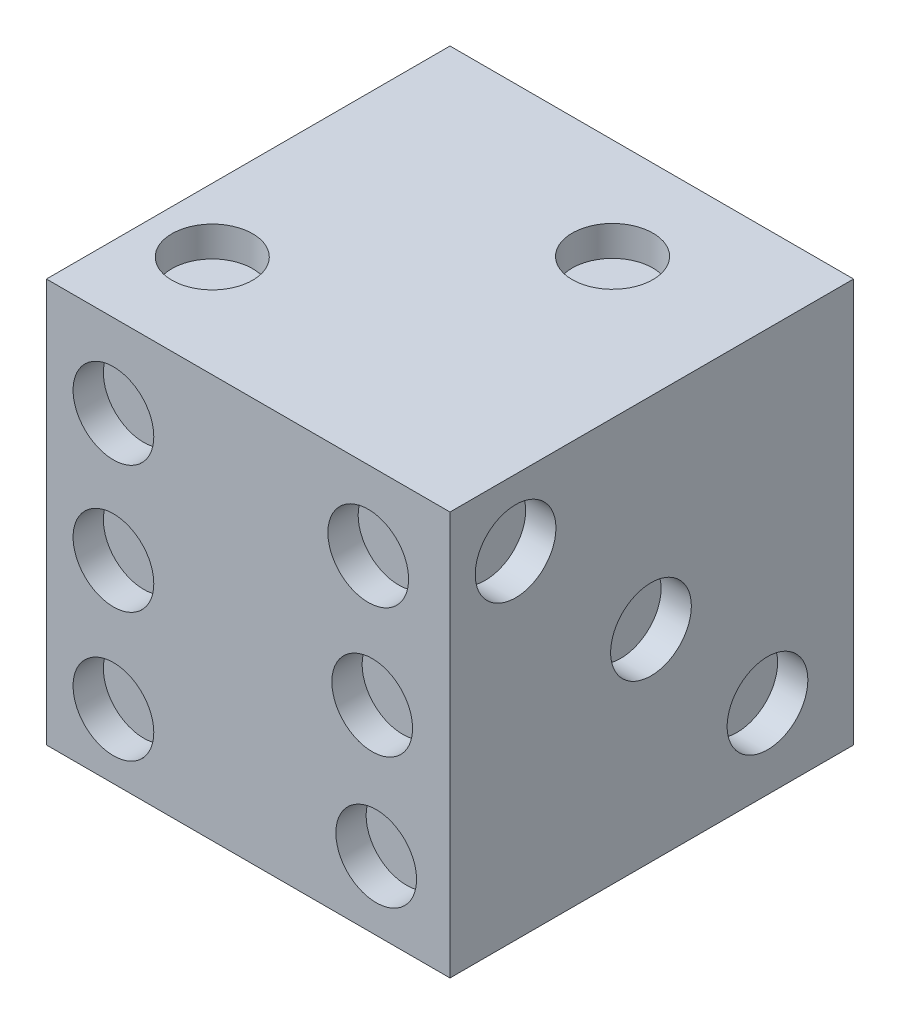
from build123d import *

# Parameters (mm, degrees)
SKETCH2_W           = 20
SKETCH2_H           = 20
BOSS_EXTRUDE1_DEPTH = 20
SKETCH3_R           = 2
CUT_EXTRUDE2_DEPTH  = 1.5
SKETCH4_R           = 2
CUT_EXTRUDE4_DEPTH  = 1.5
SKETCH5_R           = 2
CUT_EXTRUDE5_DEPTH  = 1.5
SKETCH6_R           = 2
CUT_EXTRUDE6_DEPTH  = 1.5
SKETCH7_R           = 2
CUT_EXTRUDE7_DEPTH  = 1.5
SKETCH8_R           = 2
CUT_EXTRUDE8_DEPTH  = 1.5
SKETCH9_R           = 2
CUT_EXTRUDE9_DEPTH  = 1.5


with BuildPart() as part:
    # Sketch2 → Boss-Extrude1 (new body)
    with BuildSketch(Plane.XY):
        with Locations((0, 10)):
            Rectangle(SKETCH2_W, SKETCH2_H)
    extrude(amount=BOSS_EXTRUDE1_DEPTH)

    # Sketch3 → Cut-Extrude2 (cut)
    with BuildSketch(Plane(origin=(0, 0, 0), x_dir=(-1, 0, 0), z_dir=(0, 0, -1))):
        with Locations((0, 11.387488096)):
            Circle(SKETCH3_R)
    extrude(amount=-CUT_EXTRUDE2_DEPTH, mode=Mode.SUBTRACT)

    # Sketch4 → Cut-Extrude4 (cut)
    with BuildSketch(Plane.XY.offset(20)):
        with Locations((-6.679680773, 3.199433654)):
            Circle(SKETCH4_R)
        with Locations((-6.679680773, 9.585684456)):
            Circle(SKETCH4_R)
        with Locations((-6.679680773, 15.895974219)):
            Circle(SKETCH4_R)
        with Locations(Location((5.94831499, 16.092405647, 0), (0, 0, 180))):
            Circle(SKETCH4_R)
        with Locations(Location((6.144583567, 9.785168888, 0), (0, 0, 180))):
            Circle(SKETCH4_R)
        with Locations(Location((6.343214755, 3.402007841, 0), (0, 0, 180))):
            Circle(SKETCH4_R)
    extrude(amount=-CUT_EXTRUDE4_DEPTH, mode=Mode.SUBTRACT)

    # Sketch5 → Cut-Extrude5 (cut)
    with BuildSketch(Plane.XZ):
        with Locations(Location((-7.031123571, 4.41764723, 0), (0, 0, 270))):
            Circle(SKETCH5_R)
        with Locations(Location((-7.031123571, 13.242962798, 0), (0, 0, 270))):
            Circle(SKETCH5_R)
        with Locations(Location((7.031123571, 13.242962798, 0), (0, 0, 90))):
            Circle(SKETCH5_R)
        with Locations(Location((7.031123571, 4.41764723, 0), (0, 0, 90))):
            Circle(SKETCH5_R)
    extrude(amount=-CUT_EXTRUDE5_DEPTH, mode=Mode.SUBTRACT)

    # Sketch6 → Cut-Extrude6 (cut)
    with BuildSketch(Plane(origin=(0, 20, 0), x_dir=(1, 0, 0), z_dir=(0, 1, 0))):
        with Locations(Location((-6.836211915, -14.945689643, 0), (0, 0, 270))):
            Circle(SKETCH6_R)
        with Locations(Location((3.056286481, -5.000631722, 0), (0, 0, 270))):
            Circle(SKETCH6_R)
    extrude(amount=-CUT_EXTRUDE6_DEPTH, mode=Mode.SUBTRACT)

    # Sketch7 → Cut-Extrude7 (cut)
    with BuildSketch(Plane.ZY.offset(10)):
        with Locations((15.664719218, 3.42791907)):
            Circle(SKETCH7_R)
        with Locations((6.506483369, 3.42791907)):
            Circle(SKETCH7_R)
        with Locations(Location((6.506483369, 15.851101107, 0), (0, 0, 180))):
            Circle(SKETCH7_R)
        with Locations(Location((15.664719218, 15.851101107, 0), (0, 0, 180))):
            Circle(SKETCH7_R)
    extrude(amount=-CUT_EXTRUDE7_DEPTH, mode=Mode.SUBTRACT)

    # Sketch8 → Cut-Extrude8 (cut)
    with BuildSketch(Plane.ZY.offset(10)):
        with Locations((10.73729624, 9.476774356)):
            Circle(SKETCH8_R)
    extrude(amount=-CUT_EXTRUDE8_DEPTH, mode=Mode.SUBTRACT)

    # Sketch9 → Cut-Extrude9 (cut)
    with BuildSketch(Plane(origin=(10, 0, 0), x_dir=(0, 0, -1), z_dir=(1, 0, 0))):
        with Locations((-16.749886235, 16.691371863)):
            Circle(SKETCH9_R)
        with Locations((-10.039394763, 9.986036972)):
            Circle(SKETCH9_R)
        with Locations((-4.265304833, 3.925944784)):
            Circle(SKETCH9_R)
    extrude(amount=-CUT_EXTRUDE9_DEPTH, mode=Mode.SUBTRACT)


solid = part.part
